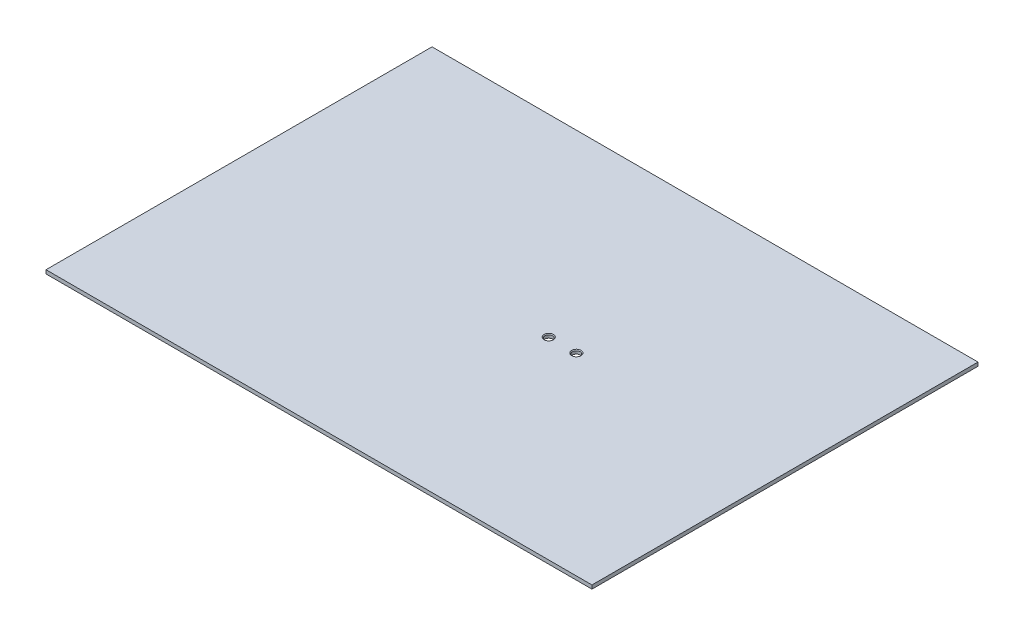
from build123d import *

# Parameters (mm, degrees)
SKETCH1_W                  = 297
SKETCH1_H                  = 210
BOSS_EXTRUDE1_DEPTH        = 2
M5_TAPPED_HOLE1_AT_2_COUNT = 2
M5_TAPPED_HOLE1_AT_2_PITCH = 15


with BuildPart() as part:
    # Sketch1 → Boss-Extrude1 (new body)
    with BuildSketch(Plane(origin=(0, 0, 0), x_dir=(1, 0, 0), z_dir=(0, 1, 0))):
        Rectangle(SKETCH1_W, SKETCH1_H)
    extrude(amount=BOSS_EXTRUDE1_DEPTH)

    # Sketch3 → M5 Tapped Hole1 (revolve, cut)
    with BuildSketch(Plane(origin=(20, 2, 0), x_dir=(0, 0, 1), z_dir=(1, 0, 0))):
        Polygon((0, 0), (0, 2), (2.1, 2), (2.1, 0.425), (2.525, 0), align=None)
    m5_tapped_hole1 = revolve(axis=Axis((20, 8.35, 0), (0, -1, 0)), mode=Mode.SUBTRACT)

    # M5 Tapped Hole1 at 2: M5 Tapped Hole1 ×2
    with Locations(*[(i * M5_TAPPED_HOLE1_AT_2_PITCH, 0, 0) for i in range(1, M5_TAPPED_HOLE1_AT_2_COUNT)]):
        add(m5_tapped_hole1, mode=Mode.SUBTRACT)


solid = part.part
